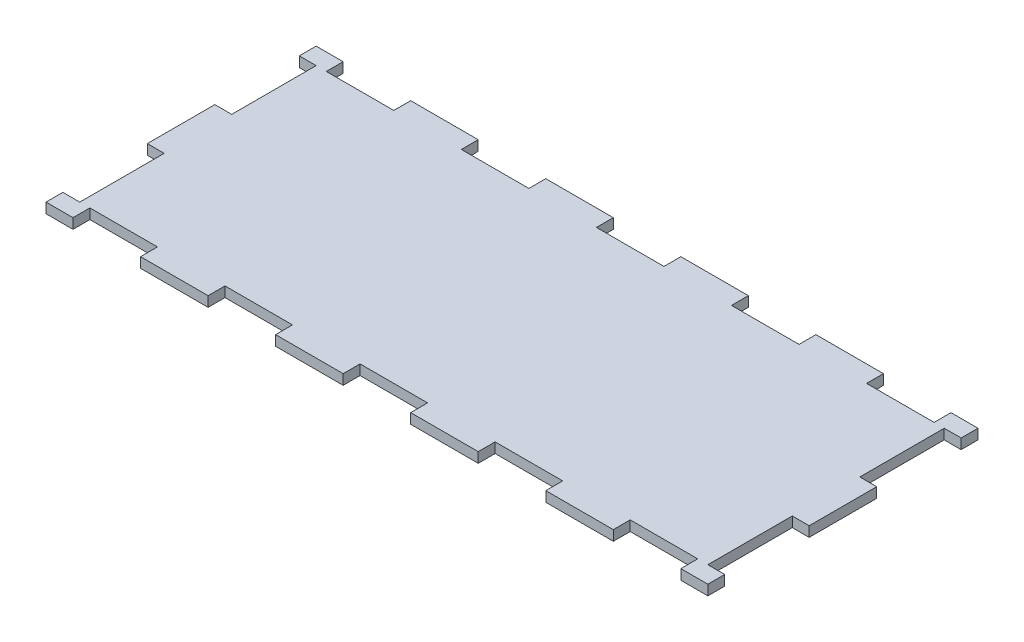
from build123d import *

# Parameters (mm, degrees)
SKETCH_1_W               = 196
SKETCH_1_H               = 80
EXTRUDE_1_DEPTH          = 3
CUT_EXTRUDE_1_REACH      = 107.891
SKETCH_2_W               = 20
SKETCH_2_H               = 5
PATTERN_LINEAR_1_COUNT   = 3
PATTERN_LINEAR_1_PITCH   = 40
PATTERN_LINEAR_2_COUNT   = 3
PATTERN_LINEAR_2_PITCH   = 40
CUT_EXTRUDE_2_REACH      = 107.891
SKETCH_3_W               = 5
SKETCH_3_H               = 25
MIRROR_2_COPY_1_REACH    = 107.891
MIRROR_2_COPY_1_SKETCH_W = 20
MIRROR_2_COPY_1_SKETCH_H = 5
MIRROR_2_COPY_2_REACH    = 107.891
MIRROR_2_COPY_2_SKETCH_W = 20
MIRROR_2_COPY_2_SKETCH_H = 5
MIRROR_2_COPY_3_REACH    = 107.891
MIRROR_2_COPY_3_SKETCH_W = 20
MIRROR_2_COPY_3_SKETCH_H = 5
MIRROR_2_COPY_4_REACH    = 107.891
MIRROR_2_COPY_4_SKETCH_W = 20
MIRROR_2_COPY_4_SKETCH_H = 5
MIRROR_5_COPY_1_REACH    = 107.891
MIRROR_5_COPY_1_SKETCH_W = 5
MIRROR_5_COPY_1_SKETCH_H = 25


with BuildPart() as part:
    # 스케치1 → 보스-돌출1 (new body)
    with BuildSketch(Plane(origin=(0, 0, 0), x_dir=(1, 0, 0), z_dir=(0, 1, 0))):
        Rectangle(SKETCH_1_W, SKETCH_1_H)
    extrude(amount=EXTRUDE_1_DEPTH)

    # 스케치2 → 컷-돌출1 (cut, up to next)
    with BuildSketch(Plane(origin=(0, 3, 0), x_dir=(1, 0, 0), z_dir=(0, 1, 0)), mode=Mode.PRIVATE) as cut_extrude_1_sk1:
        with Locations((0, -37.5)):
            Rectangle(SKETCH_2_W, SKETCH_2_H)
    cut_extrude_1_tool1 = extrude(cut_extrude_1_sk1.sketch, amount=-CUT_EXTRUDE_1_REACH, mode=Mode.PRIVATE) & part.part
    cut_extrude_1 = cut_extrude_1_tool1.solids().sort_by_distance((0, 3, 37.5))[0]
    add(cut_extrude_1, mode=Mode.SUBTRACT)

    # 선형 패턴1: 컷-돌출1 ×3
    with Locations(*[(i * PATTERN_LINEAR_1_PITCH, 0, 0) for i in range(1, PATTERN_LINEAR_1_COUNT)]):
        add(cut_extrude_1, mode=Mode.SUBTRACT)

    # 선형 패턴2: 컷-돌출1 ×3
    with Locations(*[(-i * PATTERN_LINEAR_2_PITCH, 0, 0) for i in range(1, PATTERN_LINEAR_2_COUNT)]):
        add(cut_extrude_1, mode=Mode.SUBTRACT)

    # 스케치3 → 컷-돌출2 (cut, up to next)
    with BuildSketch(Plane(origin=(0, 3, 0), x_dir=(1, 0, 0), z_dir=(0, 1, 0)), mode=Mode.PRIVATE) as cut_extrude_2_sk1:
        with Locations((95.5, -22.5)):
            Rectangle(SKETCH_3_W, SKETCH_3_H)
    cut_extrude_2_tool1 = extrude(cut_extrude_2_sk1.sketch, amount=-CUT_EXTRUDE_2_REACH, mode=Mode.PRIVATE) & part.part
    cut_extrude_2 = cut_extrude_2_tool1.solids().sort_by_distance((95.5, 3, 22.5))[0]
    add(cut_extrude_2, mode=Mode.SUBTRACT)

    # 대칭 복사2: 컷-돌출1 across plane
    add(cut_extrude_1.mirror(Plane.XY), mode=Mode.SUBTRACT)

    # 대칭 복사2 copy 1 sketch → 대칭 복사2 copy 1 (cut, up to next)
    with BuildSketch(Plane(origin=(40, 3, 0), x_dir=(1, 0, 0), z_dir=(0, 1, 0)), mode=Mode.PRIVATE) as mirror_2_copy_1_sk1:
        with Locations((0, 37.5)):
            Rectangle(MIRROR_2_COPY_1_SKETCH_W, MIRROR_2_COPY_1_SKETCH_H)
    mirror_2_copy_1_tool1 = extrude(mirror_2_copy_1_sk1.sketch, amount=-MIRROR_2_COPY_1_REACH, mode=Mode.PRIVATE) & part.part
    add(mirror_2_copy_1_tool1.solids().sort_by_distance((40, 3, -37.5))[0], mode=Mode.SUBTRACT)

    # 대칭 복사2 copy 2 sketch → 대칭 복사2 copy 2 (cut, up to next)
    with BuildSketch(Plane(origin=(80, 3, 0), x_dir=(1, 0, 0), z_dir=(0, 1, 0)), mode=Mode.PRIVATE) as mirror_2_copy_2_sk1:
        with Locations((0, 37.5)):
            Rectangle(MIRROR_2_COPY_2_SKETCH_W, MIRROR_2_COPY_2_SKETCH_H)
    mirror_2_copy_2_tool1 = extrude(mirror_2_copy_2_sk1.sketch, amount=-MIRROR_2_COPY_2_REACH, mode=Mode.PRIVATE) & part.part
    add(mirror_2_copy_2_tool1.solids().sort_by_distance((80, 3, -37.5))[0], mode=Mode.SUBTRACT)

    # 대칭 복사2 copy 3 sketch → 대칭 복사2 copy 3 (cut, up to next)
    with BuildSketch(Plane(origin=(-40, 3, 0), x_dir=(1, 0, 0), z_dir=(0, 1, 0)), mode=Mode.PRIVATE) as mirror_2_copy_3_sk1:
        with Locations((0, 37.5)):
            Rectangle(MIRROR_2_COPY_3_SKETCH_W, MIRROR_2_COPY_3_SKETCH_H)
    mirror_2_copy_3_tool1 = extrude(mirror_2_copy_3_sk1.sketch, amount=-MIRROR_2_COPY_3_REACH, mode=Mode.PRIVATE) & part.part
    add(mirror_2_copy_3_tool1.solids().sort_by_distance((-40, 3, -37.5))[0], mode=Mode.SUBTRACT)

    # 대칭 복사2 copy 4 sketch → 대칭 복사2 copy 4 (cut, up to next)
    with BuildSketch(Plane(origin=(-80, 3, 0), x_dir=(1, 0, 0), z_dir=(0, 1, 0)), mode=Mode.PRIVATE) as mirror_2_copy_4_sk1:
        with Locations((0, 37.5)):
            Rectangle(MIRROR_2_COPY_4_SKETCH_W, MIRROR_2_COPY_4_SKETCH_H)
    mirror_2_copy_4_tool1 = extrude(mirror_2_copy_4_sk1.sketch, amount=-MIRROR_2_COPY_4_REACH, mode=Mode.PRIVATE) & part.part
    add(mirror_2_copy_4_tool1.solids().sort_by_distance((-80, 3, -37.5))[0], mode=Mode.SUBTRACT)

    # 대칭 복사3: 컷-돌출2 across plane
    add(cut_extrude_2.mirror(Plane(origin=(0, 0, 0), x_dir=(0, 0, 1), z_dir=(1, 0, 0))), mode=Mode.SUBTRACT)

    # 대칭 복사5: 컷-돌출2 across plane
    add(cut_extrude_2.mirror(Plane.XY), mode=Mode.SUBTRACT)

    # 대칭 복사5 copy 1 sketch → 대칭 복사5 copy 1 (cut, up to next)
    with BuildSketch(Plane(origin=(0, 3, 0), x_dir=(-1, 0, 0), z_dir=(0, 1, 0)), mode=Mode.PRIVATE) as mirror_5_copy_1_sk1:
        with Locations((95.5, -22.5)):
            Rectangle(MIRROR_5_COPY_1_SKETCH_W, MIRROR_5_COPY_1_SKETCH_H)
    mirror_5_copy_1_tool1 = extrude(mirror_5_copy_1_sk1.sketch, amount=-MIRROR_5_COPY_1_REACH, mode=Mode.PRIVATE) & part.part
    add(mirror_5_copy_1_tool1.solids().sort_by_distance((-95.5, 3, -22.5))[0], mode=Mode.SUBTRACT)


solid = part.part
